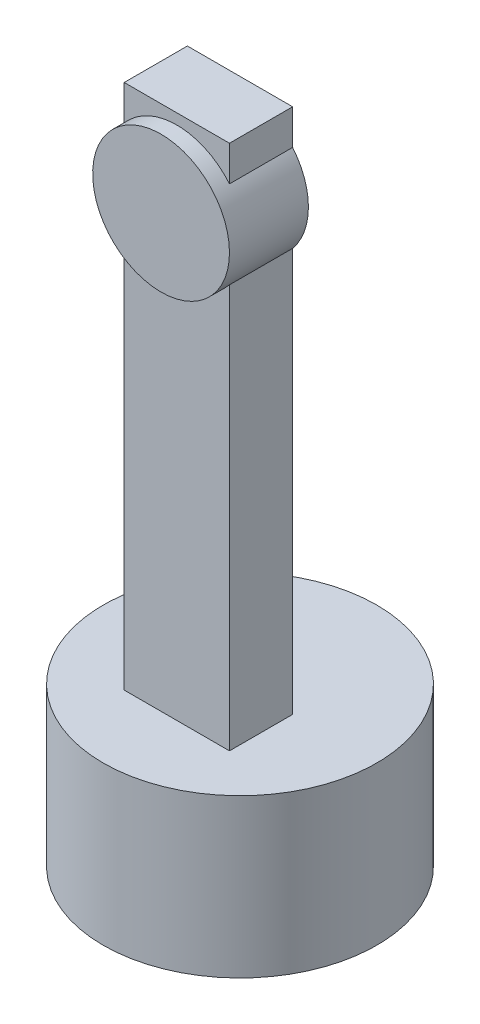
from build123d import *

# Parameters (mm, degrees)
SKETCH_1_R      = 26000
EXTRUDE_1_DEPTH = 30000
SKETCH_2_W      = 20000
SKETCH_2_H      = 104000
EXTRUDE_2_DEPTH = 12000
SKETCH_3_R      = 13000
EXTRUDE_3_DEPTH = 15000


with BuildPart() as part:
    # 草图1 → 凸台-拉伸1 (new body)
    with BuildSketch(Plane(origin=(0, 0, 0), x_dir=(1, 0, 0), z_dir=(0, 1, 0))):
        with Locations(Location((0, 0, 0), (0, 0, 270))):
            Circle(SKETCH_1_R)
    extrude(amount=EXTRUDE_1_DEPTH)

    # 草图2 → 凸台-拉伸2 (add)
    with BuildSketch(Plane.XY):
        with Locations((0, 78000)):
            Rectangle(SKETCH_2_W, SKETCH_2_H)
    extrude(amount=EXTRUDE_2_DEPTH)

    # 草图3 → 凸台-拉伸3 (add)
    with BuildSketch(Plane.XY):
        with Locations(Location((0, 115000, 0), (0, 0, 219.715137232))):
            Circle(SKETCH_3_R)
    extrude(amount=EXTRUDE_3_DEPTH)


solid = part.part
